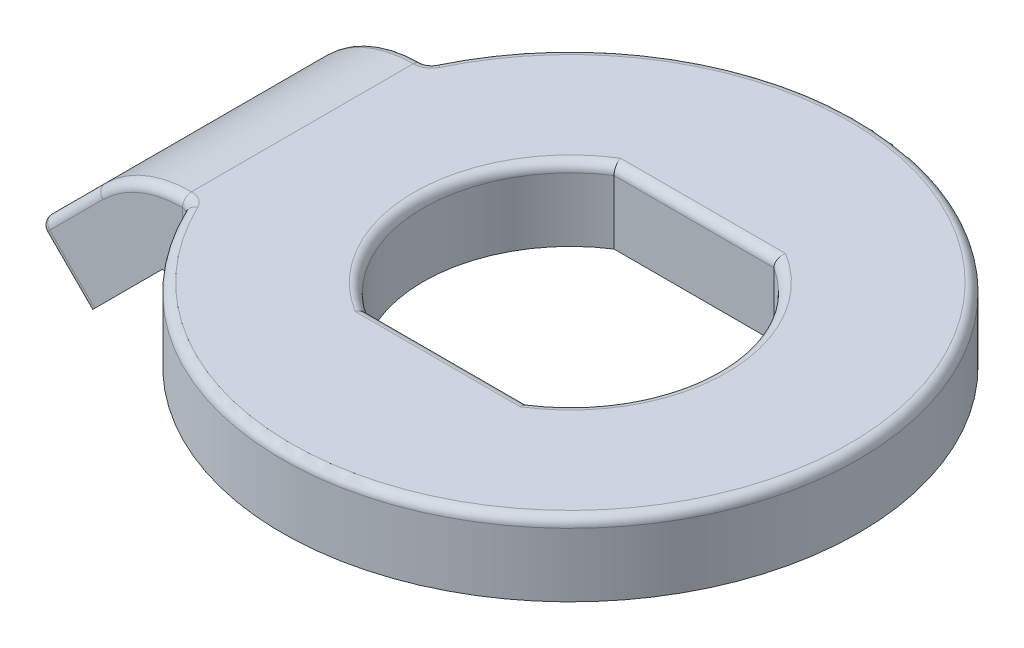
from build123d import *

# Parameters (mm, degrees)
SKETCH1_R           = 12.0269
BOSS_EXTRUDE1_DEPTH = 3.03784
BOSS_EXTRUDE2_DEPTH = 5.0038
FILLET1_R           = 5.08
FILLET2_R           = 0.381


with BuildPart() as part:
    # Sketch1 → Boss-Extrude1 (new body)
    with BuildSketch(Plane(origin=(0, 0, 0), x_dir=(1, 0, 0), z_dir=(0, 1, 0))):
        with Locations(Location((0, 0, 0), (0, 0, 270))):
            Circle(SKETCH1_R)
        with BuildLine():
            Line((-3.334475635, 5.1562), (3.334475635, 5.1562))
            ThreePointArc((3.334475635, 5.1562), (6.14045, 0), (3.334475635, -5.1562))
            Line((3.334475635, -5.1562), (-3.334475635, -5.1562))
            ThreePointArc((-3.334475635, -5.1562), (-6.14045, 0), (-3.334475635, 5.1562))
        make_face(mode=Mode.SUBTRACT)
    extrude(amount=BOSS_EXTRUDE1_DEPTH)

    # Sketch3 → Boss-Extrude2 (add, symmetric)
    with BuildSketch(Plane.XY):
        Polygon((-6.14045, 3.03784), (-13.285214528, 3.03784), (-17.255205114, -0.932150585), (-15.10712785, -3.08022785), (-12.0269, 0), (-6.14045, 0), align=None)
    extrude(amount=BOSS_EXTRUDE2_DEPTH, both=True)

    # Fillet1
    fillet1_edges = [part.edges().sort_by_distance(p)[0] for p in [
        (-13.285214528, 3.03784, 0),
    ]]
    fillet(fillet1_edges, radius=FILLET1_R)

    # Fillet2
    fillet2_edges = [part.edges().sort_by_distance(p)[0] for p in [
        (6.14045, 3.03784, 0),
        (0, 3.03784, -5.1562),
        (12.0269, 3.03784, 0),
        (-10.936558379, 1.51892, -5.0038),
        (-10.936558379, 1.51892, 5.0038),
        (-11.058784005, 3.03784, 5.0038),
        (-16.181166482, -2.006189217, 5.0038),
        (-11.058784005, 3.03784, -5.0038),
        (-16.181166482, -2.006189217, -5.0038),
        (-17.255205114, -0.932150585, 0),
        (-16.014158597, 0.308895932, -5.0038),
        (-16.014158597, 0.308895932, 5.0038),
        (-13.125041468, 2.651148025, -5.0038),
        (-13.125041468, 2.651148025, 5.0038),
        (-6.14045, 3.03784, 0),
        (0, 3.03784, 5.1562),
    ]]
    fillet(fillet2_edges, radius=FILLET2_R)


solid = part.part
